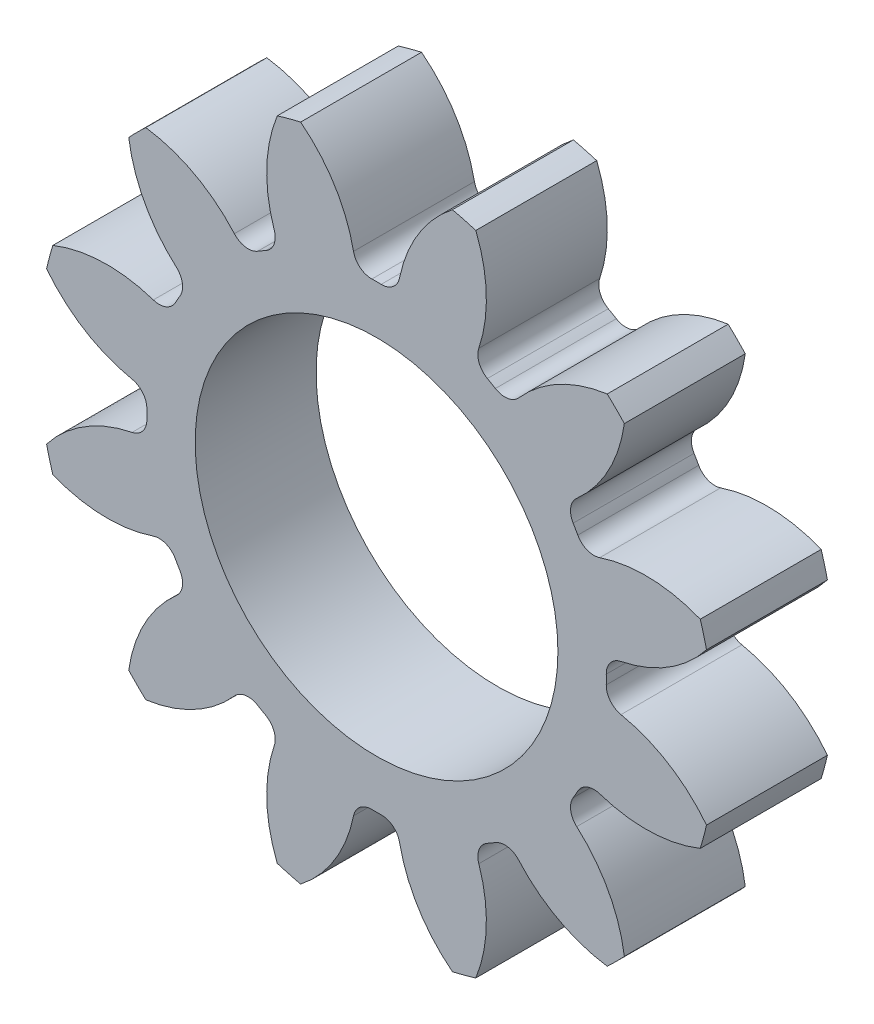
from build123d import *

# Parameters (mm, degrees)
SKETCH1_R                = 14
BOSS_EXTRUDE1_DEPTH      = 5
CUT_EXTRUDE1_DEPTH       = 10
FILLET2_R                = 0.76
CIRPATTERN2_COUNT        = 12
FILLET2_OF_CIRPATTERN2_R = 0.76
SKETCH2_R                = 7.5
CUT_EXTRUDE2_DEPTH       = 5


with BuildPart() as part:
    # Sketch1 → Boss-Extrude1 (new body)
    with BuildSketch(Plane.XY):
        Circle(SKETCH1_R)
    extrude(amount=-BOSS_EXTRUDE1_DEPTH)

    # Sketch1<4> → Cut-Extrude1 (cut)
    with BuildSketch(Plane.XY):
        with BuildLine():
            ThreePointArc((-0.857546411, 9.461216315), (0, 9.5), (0.857546411, 9.461216315))
            ThreePointArc((0.857546411, 9.461216315), (1.564361536, 11.788884259), (3.138269843, 13.643726118))
            ThreePointArc((3.138269843, 13.643726118), (0, 14), (-3.138269843, 13.643726118))
            ThreePointArc((-3.138269843, 13.643726118), (-1.564361536, 11.788884259), (-0.857546411, 9.461216315))
        make_face()
    cut_extrude1 = extrude(amount=-CUT_EXTRUDE1_DEPTH, mode=Mode.SUBTRACT)

    # Fillet2
    fillet2_edges = [part.edges().sort_by_distance(p)[0] for p in [
        (0.857546411, 9.461216315, -2.5),
        (-0.857546411, 9.461216315, -2.5),
    ]]
    fillet(fillet2_edges, radius=FILLET2_R)

    # CirPattern2: Cut-Extrude1 ×12 about axis
    cirpattern2_axis = Axis((0, 0, 0), (0, 0, 1))
    for i in range(1, CIRPATTERN2_COUNT):
        add(cut_extrude1.rotate(cirpattern2_axis, i * 360 / CIRPATTERN2_COUNT), mode=Mode.SUBTRACT)

    # Fillet2 of CirPattern2
    fillet2_of_cirpattern2_edges = [part.edges().sort_by_distance(p)[0] for p in [
        (-3.98795118, 8.622426885, -2.5),
        (-5.473265134, 7.764880474, -2.5),
        (-7.764880474, 5.473265134, -2.5),
        (-8.622426885, 3.98795118, -2.5),
        (-9.461216315, 0.857546411, -2.5),
        (-9.461216315, -0.857546411, -2.5),
        (-8.622426885, -3.98795118, -2.5),
        (-7.764880474, -5.473265134, -2.5),
        (-5.473265134, -7.764880474, -2.5),
        (-3.98795118, -8.622426885, -2.5),
        (-0.857546411, -9.461216315, -2.5),
        (0.857546411, -9.461216315, -2.5),
        (3.98795118, -8.622426885, -2.5),
        (5.473265134, -7.764880474, -2.5),
        (7.764880474, -5.473265134, -2.5),
        (8.622426885, -3.98795118, -2.5),
        (9.461216315, -0.857546411, -2.5),
        (9.461216315, 0.857546411, -2.5),
        (8.622426885, 3.98795118, -2.5),
        (7.764880474, 5.473265134, -2.5),
        (5.473265134, 7.764880474, -2.5),
        (3.98795118, 8.622426885, -2.5),
    ]]
    fillet(fillet2_of_cirpattern2_edges, radius=FILLET2_OF_CIRPATTERN2_R)

    # Sketch2 → Cut-Extrude2 (cut)
    with BuildSketch(Plane.XY):
        Circle(SKETCH2_R)
    extrude(amount=-CUT_EXTRUDE2_DEPTH, mode=Mode.SUBTRACT)


solid = part.part
